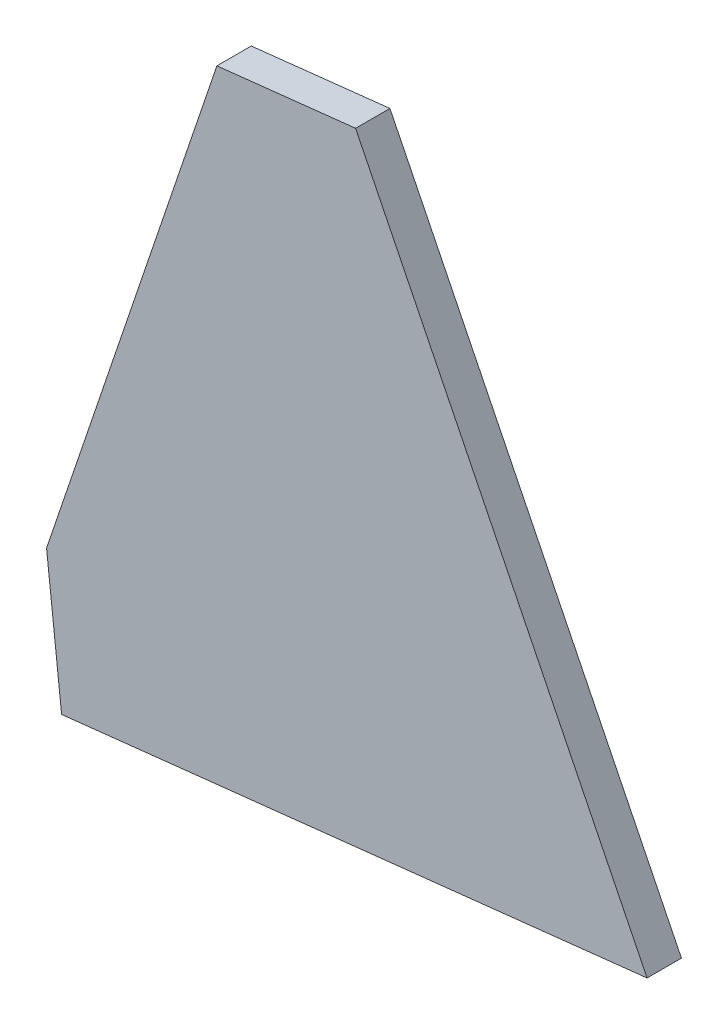
from build123d import *

# Parameters (mm, degrees)
BOSS_EXTRU_1_DEPTH = 10


with BuildPart() as part:
    # Esquisse1 → Boss.-Extru.1 (new body)
    with BuildSketch(Plane.XY):
        Polygon((-66.481363948, -169.24764993), (103.944522313, -150.469238714), (19.09010759, 21.312829114), (-21.282618086, 16.864352059), (-70.862258641, -129.488276674), align=None)
    extrude(amount=BOSS_EXTRU_1_DEPTH)


solid = part.part
